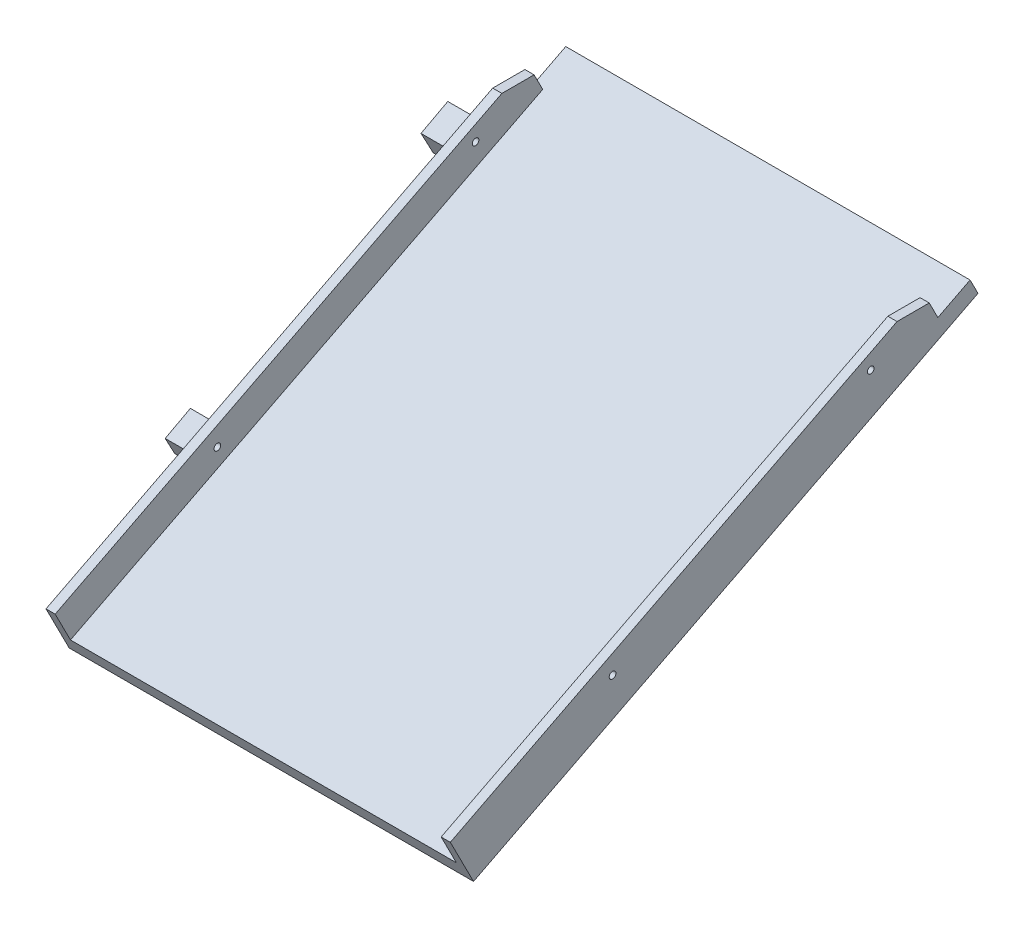
from build123d import *

# Parameters (mm, degrees)
BOSS_EXTRUDE1_DEPTH     = 1321.809345804
BOSS_EXTRUDE2_DEPTH     = 110
BOSS_EXTRUDE4_DEPTH     = 80
CUT_EXTRUDE1_DEPTH      = 390
CUT_EXTRUDE1_DEPTH_BACK = 1710
SKETCH4_R               = 10.935754795
SKETCH4_R_2             = 10.805085865
CUT_EXTRUDE2_DEPTH      = 10
CUT_EXTRUDE2_DEPTH_BACK = 1600
CUT_EXTRUDE3_DEPTH      = 1600
CUT_EXTRUDE3_DEPTH_BACK = 1800
SKETCH7_W               = 1261.809345804
SKETCH7_H               = 148.826585301


with BuildPart() as part:
    # Sketch1 → Boss-Extrude1 (new body)
    with BuildSketch(Plane(origin=(0, 0, 0), x_dir=(0, 0, -1), z_dir=(1, 0, 0))):
        Polygon((0, 0), (1214.174590511, 618.652853995), (1188.297132026, 669.440225874), (-25.877458485, 50.787371879), (-460.955944246, -170.896189144), (-435.078485761, -221.683561023), align=None)
    extrude(amount=-BOSS_EXTRUDE1_DEPTH)

    # Sketch2 → Boss-Extrude2 (add)
    with BuildSketch(Plane(origin=(0, 50.787371879, 25.877458485), x_dir=(1, 0, 0), z_dir=(0, 0.8910065241883673, 0.453990499739548))):
        Polygon((0, 0), (0, -488.3), (-67.842597561, -488.3), (-67.842597561, 0), (-67.842597561, 1244.513029496), (0, 1244.513029496), align=None)
        Polygon((-1321.809345804, 0), (-1321.809345804, 1244.513029496), (-1253.966748243, 1244.513029496), (-1253.966748243, 0), (-1253.966748243, -488.3), (-1321.809345804, -488.3), align=None)
    extrude(amount=BOSS_EXTRUDE2_DEPTH)

    # Sketch3 → Boss-Extrude4 (add)
    with BuildSketch(Plane.ZY.offset(1321.809345804)):
        Polygon((-882.563635412, 626.858827585), (-795.042959323, 580.236826077), (-834.961493519, 505.300165527), (-922.482169607, 551.922167035), align=None)
        Polygon((-41.133790816, 178.631674443), (41.227375134, 134.758128502), (9.982813434, 76.104594213), (-72.378352516, 119.978140155), align=None)
    extrude(amount=BOSS_EXTRUDE4_DEPTH)

    # Sketch4 → Cut-Extrude1 (cut, two sides: drawn at the far end of the back side and taken through both)
    with BuildSketch(Plane(origin=(0, 0, 0), x_dir=(0, 0, -1), z_dir=(1, 0, 0)).offset(-CUT_EXTRUDE1_DEPTH_BACK)):
        with Locations(Location((19.453016292, 135.017213441, 0), (0, 0, 180))):
            Circle(SKETCH4_R)
        with Locations(Location((863.462816879, 576.936245259, 0), (0, 0, 180))):
            Circle(SKETCH4_R_2)
    extrude(amount=CUT_EXTRUDE1_DEPTH + CUT_EXTRUDE1_DEPTH_BACK, mode=Mode.SUBTRACT)

    # Sketch5 → Cut-Extrude2 (cut, two sides: drawn at the far end of the back side and taken through both)
    with BuildSketch(Plane(origin=(0, 0, 0), x_dir=(0, 0, -1), z_dir=(1, 0, 0)).offset(-CUT_EXTRUDE2_DEPTH_BACK)):
        Polygon((1033.052815262, 713.795181733), (1054.736624804, 671.238309325), (949.530250393, 671.238309325), align=None)
    extrude(amount=CUT_EXTRUDE2_DEPTH + CUT_EXTRUDE2_DEPTH_BACK, mode=Mode.SUBTRACT)

    # Sketch7 → Cut-Extrude3 (cut, two sides: drawn at the far end of the back side and taken through both)
    with BuildSketch(Plane(origin=(0, -221.683561023, 435.078485761), x_dir=(1, 0, 0), z_dir=(0, -0.453990499739547, 0.8910065241883678)).offset(-CUT_EXTRUDE3_DEPTH_BACK)):
        with Locations((-660.904672902, 131.413292651)):
            Rectangle(SKETCH7_W, SKETCH7_H)
    extrude(amount=CUT_EXTRUDE3_DEPTH + CUT_EXTRUDE3_DEPTH_BACK, mode=Mode.SUBTRACT)


solid = part.part
